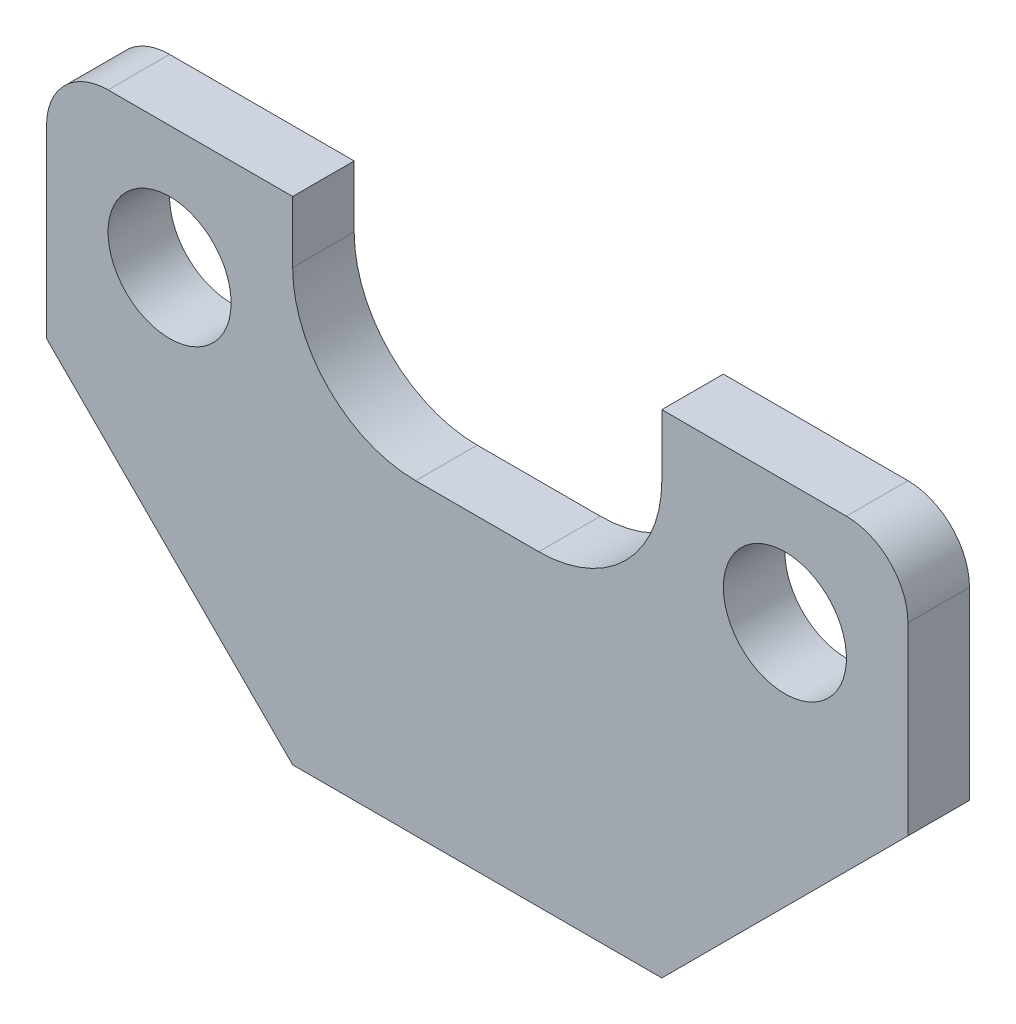
from build123d import *

# Parameters (mm, degrees)
SKETCH1_R           = 5
BOSS_EXTRUDE1_DEPTH = 5


with BuildPart() as part:
    # Sketch1 → Boss-Extrude1 (new body)
    with BuildSketch(Plane.XY):
        with BuildLine():
            Line((-35, 0), (-15, -20))
            Line((-15, -20), (15, -20))
            Line((15, -20), (35, 0))
            Line((35, 0), (35, 15))
            ThreePointArc((35, 15), (33.535533906, 18.535533906), (30, 20))
            Line((30, 20), (15, 20))
            Line((15, 20), (15, 15))
            ThreePointArc((15, 15), (12.071067812, 7.928932188), (5, 5))
            Line((5, 5), (-5, 5))
            ThreePointArc((-5, 5), (-12.071067812, 7.928932188), (-15, 15))
            Line((-15, 15), (-15, 20))
            Line((-15, 20), (-30, 20))
            ThreePointArc((-30, 20), (-33.535533906, 18.535533906), (-35, 15))
            Line((-35, 15), (-35, 0))
        make_face()
        with Locations((-25, 10)):
            Circle(SKETCH1_R, mode=Mode.SUBTRACT)
        with Locations(Location((25, 10, 0), (0, 0, 180))):
            Circle(SKETCH1_R, mode=Mode.SUBTRACT)
    extrude(amount=BOSS_EXTRUDE1_DEPTH)


solid = part.part
